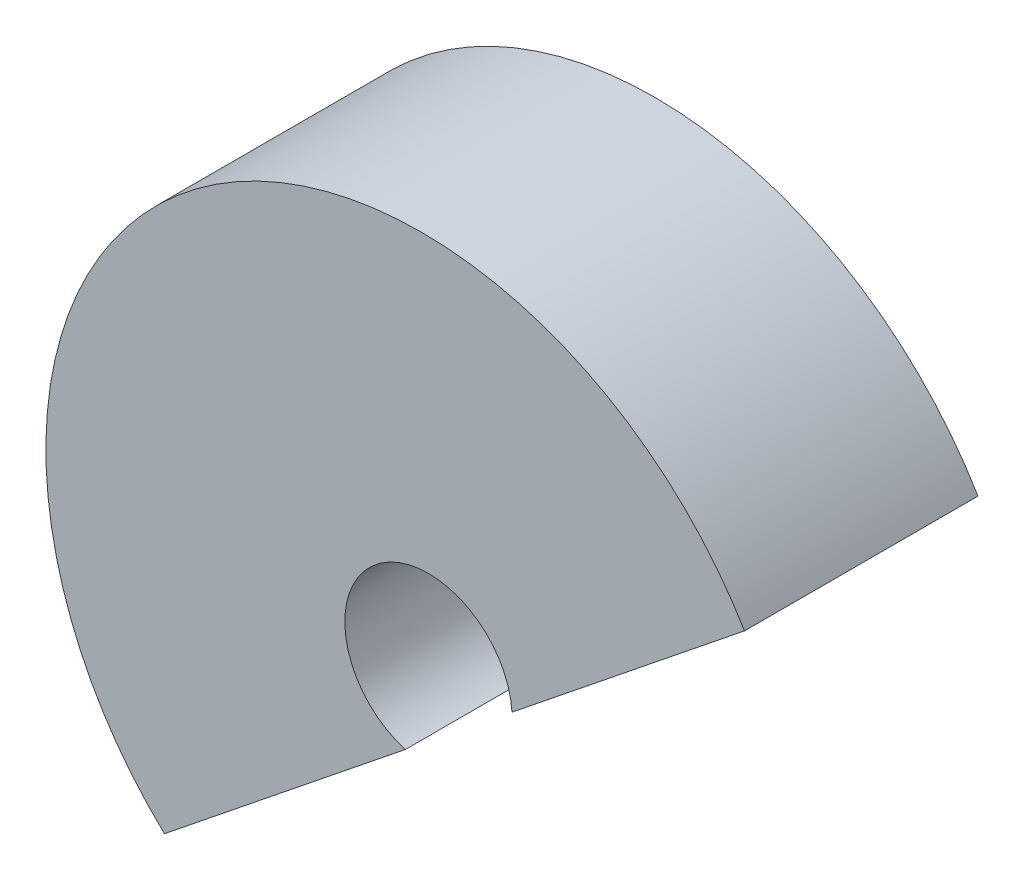
from build123d import *

# Parameters (mm, degrees)
SKETCH1_R               = 64.345413168
BOSS_EXTRUDE1_DEPTH     = 40
SKETCH3_R               = 14.331573803
CUT_EXTRUDE2_DEPTH      = 40
CUT_EXTRUDE3_DEPTH      = 179.175578552
CUT_EXTRUDE3_DEPTH_BACK = 40
SKETCH5_R               = 17.792090532
CUT_EXTRUDE6_DEPTH      = 18


with BuildPart() as part:
    # Sketch1 → Boss-Extrude1 (new body)
    with BuildSketch(Plane.XY):
        with Locations((-96.918980287, 0)):
            Circle(SKETCH1_R)
    extrude(amount=BOSS_EXTRUDE1_DEPTH)

    # Sketch3 → Cut-Extrude2 (cut)
    with BuildSketch(Plane.XY.offset(40)):
        with Locations((-95.729315352, 0)):
            Circle(SKETCH3_R)
    extrude(amount=-CUT_EXTRUDE2_DEPTH, mode=Mode.SUBTRACT)

    # Sketch4 → Cut-Extrude3 (cut, two sides: drawn at the far end of the back side and taken through both)
    with BuildSketch(Plane.XY.offset(40).offset(-CUT_EXTRUDE3_DEPTH_BACK)):
        Polygon((268.087714355, 281.481110593), (-21.116990888, 49.302685257), (-148.180972854, -52.706427026), (-437.385678097, -284.884852362), (26.971172575, -863.294262848), (732.444565027, -296.928299893), align=None)
    extrude(amount=CUT_EXTRUDE3_DEPTH + CUT_EXTRUDE3_DEPTH_BACK, mode=Mode.SUBTRACT)

    # Sketch5 → Cut-Extrude6 (cut)
    with BuildSketch(Plane(origin=(-32.344640606, 40.288938299, 0), x_dir=(0.7797961442184731, 0.626033524231732, 0), z_dir=(0.626033524231732, -0.7797961442184731, 0))):
        with Locations((-34.092669142, 19.900069025)):
            Circle(SKETCH5_R)
    extrude(amount=-CUT_EXTRUDE6_DEPTH, mode=Mode.SUBTRACT)


solid = part.part
